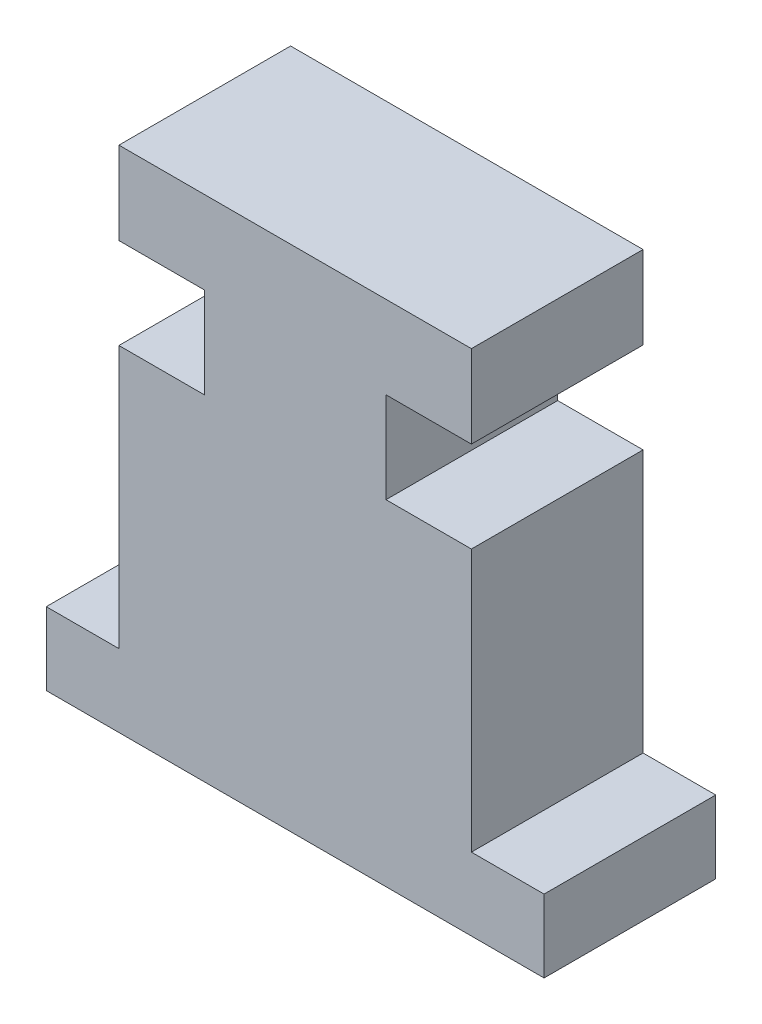
from build123d import *

# Parameters (mm, degrees)
SKETCH1_W           = 12.319
SKETCH1_H           = 6
BOSS_EXTRUDE1_DEPTH = 15.24
SKETCH1_3_W         = 17.399
SKETCH1_3_H         = 6
BOSS_EXTRUDE2_DEPTH = 2.54
SKETCH2_W           = 2.9845
SKETCH2_H           = 3.175
CUT_EXTRUDE1_DEPTH  = 19.545589779


with BuildPart() as part:
    # Sketch1 → Boss-Extrude1 (new body)
    with BuildSketch(Plane(origin=(0, 0, 0), x_dir=(1, 0, 0), z_dir=(0, 1, 0))):
        Rectangle(SKETCH1_W, SKETCH1_H)
    extrude(amount=BOSS_EXTRUDE1_DEPTH)

    # Sketch1<3> → Boss-Extrude2 (add)
    with BuildSketch(Plane(origin=(0, 0, 0), x_dir=(1, 0, 0), z_dir=(0, 1, 0))):
        Rectangle(SKETCH1_3_W, SKETCH1_3_H)
    extrude(amount=-BOSS_EXTRUDE2_DEPTH)

    # Sketch2 → Cut-Extrude1 (cut, through all)
    with BuildSketch(Plane(origin=(0, 0, -3), x_dir=(-1, 0, 0), z_dir=(0, 0, -1))):
        with Locations((-4.66725, 10.7625)):
            Rectangle(SKETCH2_W, SKETCH2_H)
        with Locations((4.66725, 10.7625)):
            Rectangle(SKETCH2_W, SKETCH2_H)
    extrude(amount=-CUT_EXTRUDE1_DEPTH, mode=Mode.SUBTRACT)


solid = part.part
